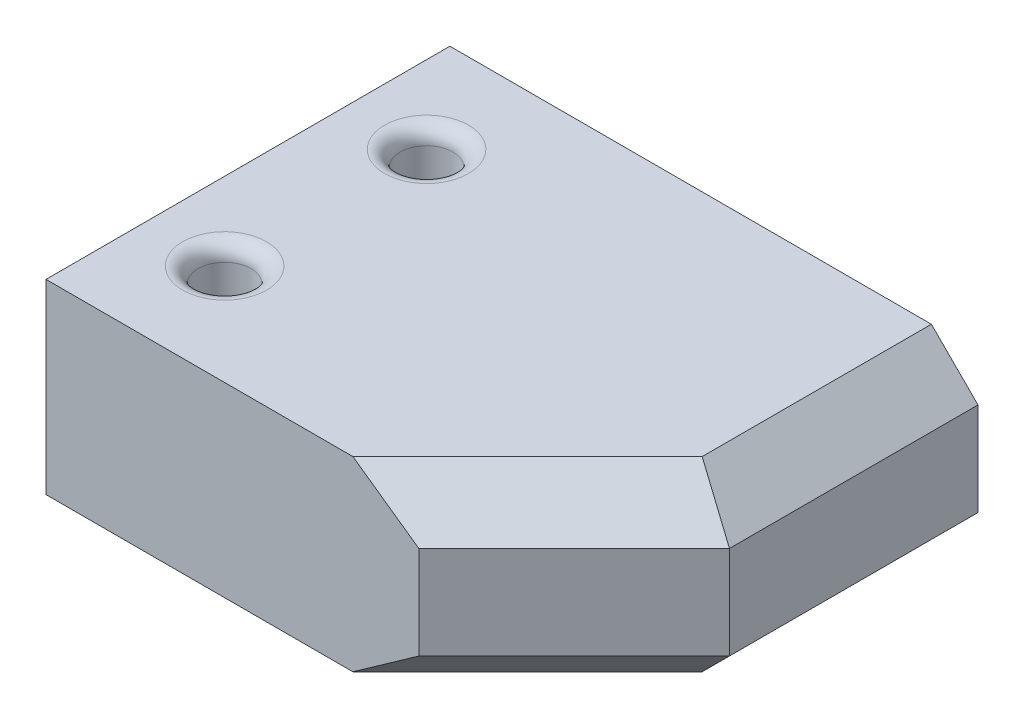
from build123d import *

# Parameters (mm, degrees)
SKETCH1_W               = 17
SKETCH1_H               = 13
BOSS_EXTRUDE1_DEPTH     = 6
CUT_EXTRUDE1_DEPTH      = 20.163767897
CUT_EXTRUDE1_DEPTH_BACK = 20.163767897
SKETCH2_R               = 0.85
FILLET1_R               = 0.5
CHAMFER1_SIZE           = 5
CHAMFER2_SIZE           = 1.5


with BuildPart() as part:
    # Sketch1 → Boss-Extrude1 (new body)
    with BuildSketch(Plane(origin=(0, 0, 0), x_dir=(1, 0, 0), z_dir=(0, 1, 0))):
        with Locations((8.5, 0)):
            Rectangle(SKETCH1_W, SKETCH1_H)
    extrude(amount=BOSS_EXTRUDE1_DEPTH)

    # Sketch2 → Cut-Extrude1 (cut, two sides: drawn at the far end of the back side and taken through both)
    with BuildSketch(Plane(origin=(0, 6, 0), x_dir=(1, 0, 0), z_dir=(0, 1, 0)).offset(-CUT_EXTRUDE1_DEPTH_BACK)):
        with Locations(Location((2.5, 3.25, 0), (0, 0, 270))):
            Circle(SKETCH2_R)
        with Locations(Location((2.5, -3.25, 0), (0, 0, 270))):
            Circle(SKETCH2_R)
    extrude(amount=CUT_EXTRUDE1_DEPTH + CUT_EXTRUDE1_DEPTH_BACK, mode=Mode.SUBTRACT)

    # Fillet1
    fillet1_edges = [part.edges().sort_by_distance(p)[0] for p in [
        (2.5, 0, -4.1),
        (2.5, 6, -4.1),
        (2.5, 0, 2.4),
        (2.5, 6, 2.4),
    ]]
    fillet(fillet1_edges, radius=FILLET1_R)

    # Chamfer1
    chamfer1_edges = [part.edges().sort_by_distance(p)[0] for p in [
        (17, 3, 6.5),
    ]]
    chamfer(chamfer1_edges, length=CHAMFER1_SIZE)

    # Chamfer2
    chamfer2_edges = [part.edges().sort_by_distance(p)[0] for p in [
        (17, 0, -2.5),
        (17, 6, -2.5),
        (14.5, 0, 4),
        (14.5, 6, 4),
    ]]
    chamfer(chamfer2_edges, length=CHAMFER2_SIZE)


solid = part.part
